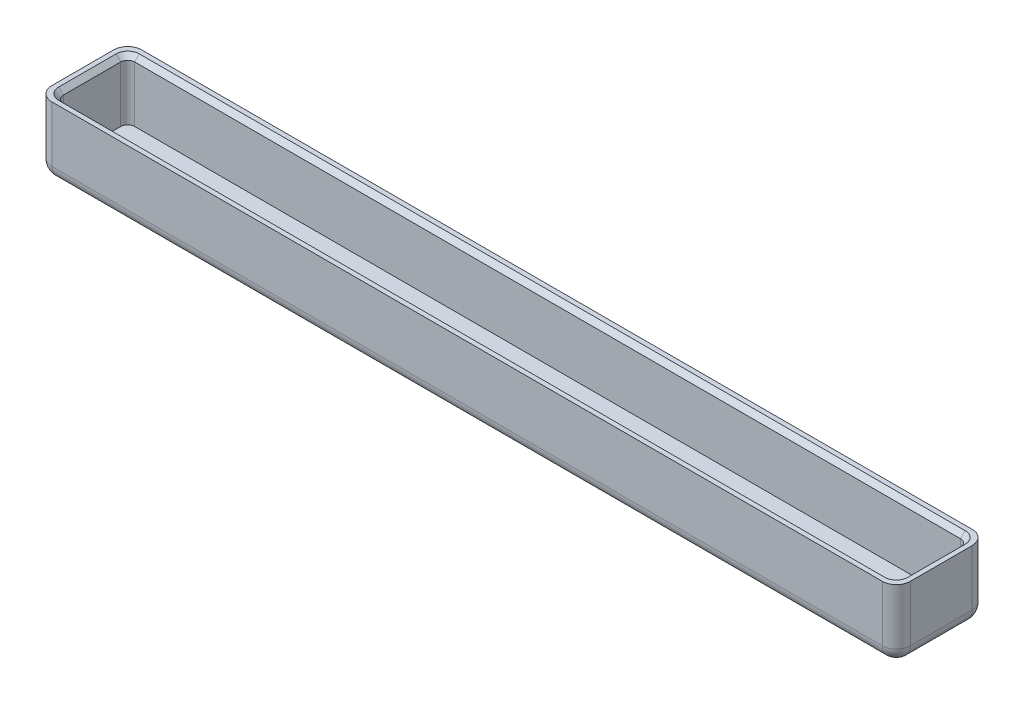
from build123d import *

# Parameters (mm, degrees)
SKETCH2_W           = 184.3
SKETCH2_H           = 19.3
BOSS_EXTRUDE1_DEPTH = 15
SHELL1_T            = -2
FILLET1_R           = 3
FILLET2_R           = 1.5
CHAMFER1_SIZE       = 1


with BuildPart() as part:
    # Sketch2 → Boss-Extrude1 (new body)
    with BuildSketch(Plane(origin=(0, 0, 0), x_dir=(1, 0, 0), z_dir=(0, 1, 0))):
        Rectangle(SKETCH2_W, SKETCH2_H)
    extrude(amount=BOSS_EXTRUDE1_DEPTH)

    # Shell1
    shell1_openings = [part.faces().sort_by_distance(p)[0] for p in [
        (0, 15, 0),
    ]]
    offset(amount=SHELL1_T, openings=shell1_openings, kind=Kind.INTERSECTION)

    # Fillet1
    fillet1_edges = [part.edges().sort_by_distance(p)[0] for p in [
        (0, 0, 9.65),
        (-92.15, 0, 0),
        (0, 0, -9.65),
        (92.15, 0, 0),
        (92.15, 7.5, 9.65),
        (-92.15, 7.5, 9.65),
        (-92.15, 7.5, -9.65),
        (92.15, 7.5, -9.65),
    ]]
    fillet(fillet1_edges, radius=FILLET1_R)

    # Fillet2
    fillet2_edges = [part.edges().sort_by_distance(p)[0] for p in [
        (90.15, 8.5, 7.65),
        (90.15, 8.5, -7.65),
        (-90.15, 8.5, -7.65),
        (-90.15, 8.5, 7.65),
    ]]
    fillet(fillet2_edges, radius=FILLET2_R)

    # Chamfer1
    chamfer1_edges = [part.edges().sort_by_distance(p)[0] for p in [
        (0, 15, 7.65),
        (90.15, 15, 0),
        (0, 15, -7.65),
        (-90.15, 15, 0),
        (89.710660172, 15, 7.210660172),
        (89.710660172, 15, -7.210660172),
        (-89.710660172, 15, 7.210660172),
        (-89.710660172, 15, -7.210660172),
    ]]
    chamfer(chamfer1_edges, length=CHAMFER1_SIZE)


solid = part.part
